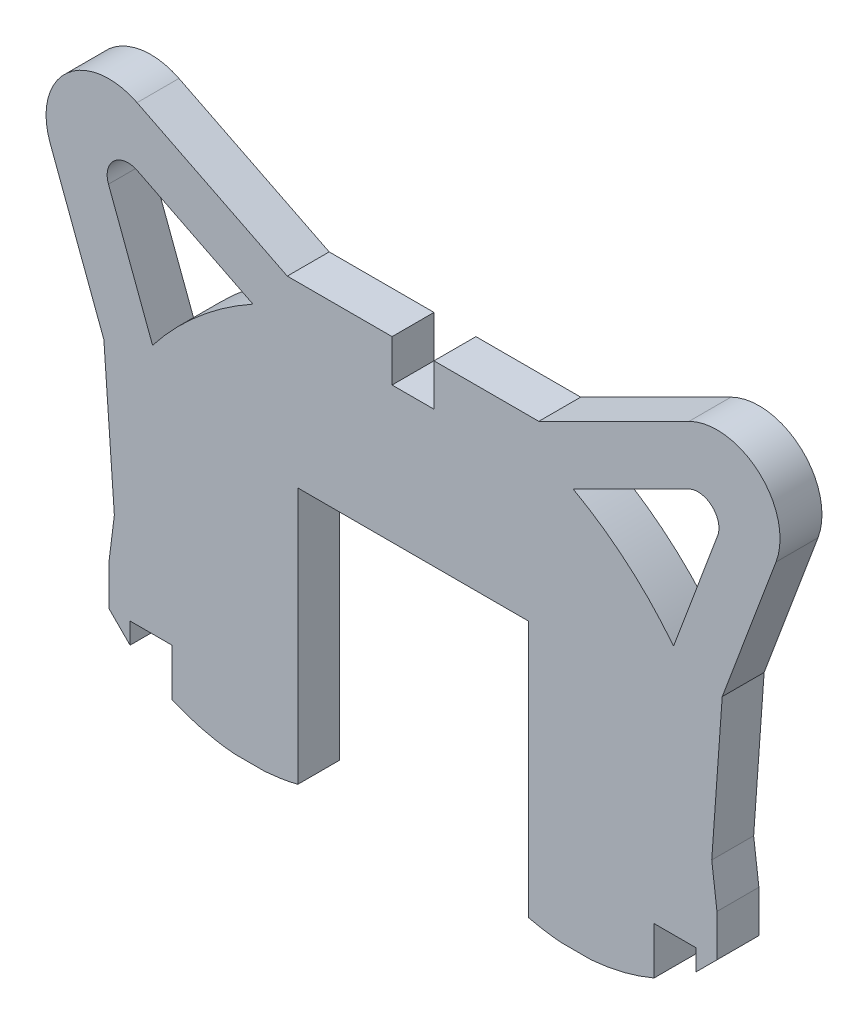
from build123d import *

# Parameters (mm, degrees)
ESTRUSIONE_ESTRUSIONE1_DEPTH = 4


with BuildPart() as part:
    # Schizzo1 → Estrusione-Estrusione1 (new body)
    with BuildSketch(Plane.XY):
        with BuildLine():
            Line((2, -11), (-2, -11))
            Line((-2, -11), (-2, -7))
            Line((-2, -7), (-12, -7))
            Line((-12, -7), (-26.333851616, 0.166925808))
            ThreePointArc((-26.333851616, 0.166925808), (-33.031566385, -0.74045287), (-34.635108255, -7.306377987))
            Line((-34.635108255, -7.306377987), (-29.5, -21))
            Line((-29.5, -21), (-28.5, -35))
            Line((-28.5, -35), (-29, -39))
            Line((-29, -39), (-29, -43))
            Line((-29, -43), (-27, -45))
            Line((-27, -45), (-27, -43))
            Line((-27, -43), (-23, -43))
            Line((-23, -43), (-23, -47.5))
            add(Edge.make_bspline(
                [(-23, -47.5), (-20.041371852, -48.760160273), (-17, -49)],
                knots=[0, 0, 0, 0.506712619, 0.506712619, 0.506712619], degree=2))
            Line((-17, -49), (-14.122054723, -49))
            add(Edge.make_bspline(
                [(-14.122054723, -49), (-12.571510592, -48.87926972), (-11, -48.5)],
                knots=[0.744931513, 0.744931513, 0.744931513, 1, 1, 1], degree=2))
            Line((-11, -48.5), (-11, -24))
            Line((-11, -24), (11, -24))
            Line((11, -24), (11, -48.5))
            add(Edge.make_bspline(
                [(11, -48.5), (12.571510592, -48.87926972), (14.122054723, -49)],
                knots=[0, 0, 0, 0.255068487, 0.255068487, 0.255068487], degree=2))
            Line((14.122054723, -49), (17, -49))
            add(Edge.make_bspline(
                [(17, -49), (20.041371852, -48.760160273), (23, -47.5)],
                knots=[0.493287381, 0.493287381, 0.493287381, 1, 1, 1], degree=2))
            Line((23, -47.5), (23, -43))
            Line((23, -43), (27, -43))
            Line((27, -43), (27, -45))
            Line((27, -45), (29, -43))
            Line((29, -43), (29, -39))
            Line((29, -39), (28.5, -35))
            Line((28.5, -35), (29.5, -21))
            Line((29.5, -21), (34.635108255, -7.306377987))
            ThreePointArc((34.635108255, -7.306377987), (33.031566385, -0.74045287), (26.333851616, 0.166925808))
            Line((26.333851616, 0.166925808), (12, -7))
            Line((12, -7), (2, -7))
            Line((2, -7), (2, -11))
        make_face()
        with BuildLine():
            ThreePointArc((24.854524092, -19.147929512), (20.47953862, -14.565955254), (15.276187318, -10.952076285))
            Line((15.276187318, -10.952076285), (26.292228197, -5.444055845))
            ThreePointArc((26.292228197, -5.444055845), (28.524799786, -5.746515405), (29.059313743, -7.935157111))
            Line((29.059313743, -7.935157111), (24.854524092, -19.147929512))
        make_face(mode=Mode.SUBTRACT)
        with BuildLine():
            ThreePointArc((-29.059313743, -7.935157111), (-28.524799786, -5.746515405), (-26.292228197, -5.444055845))
            Line((-26.292228197, -5.444055845), (-15.276187318, -10.952076285))
            ThreePointArc((-15.276187318, -10.952076285), (-20.47953862, -14.565955254), (-24.854524092, -19.147929512))
            Line((-24.854524092, -19.147929512), (-29.059313743, -7.935157111))
        make_face(mode=Mode.SUBTRACT)
    extrude(amount=ESTRUSIONE_ESTRUSIONE1_DEPTH)


solid = part.part
